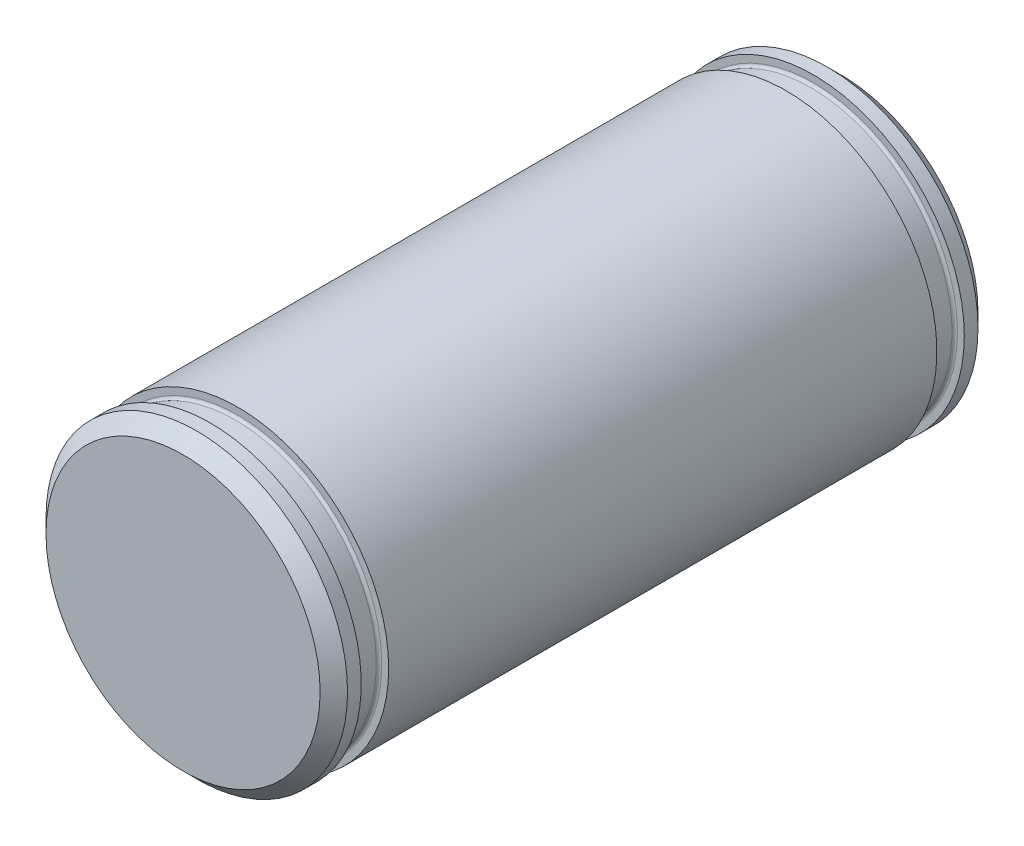
from build123d import *

# Parameters (mm, degrees)
ESQUISSE1_R      = 5.5
EXTRUSION1_DEPTH = 12
CHANFREIN1_SIZE  = 0.5
CHANFREIN2_SIZE  = 0.5


with BuildPart() as part:
    # Esquisse1 → Extrusion1 (new, symmetric)
    with BuildSketch(Plane.XY):
        Circle(ESQUISSE1_R)
    extrude(amount=EXTRUSION1_DEPTH, both=True)

    # Chanfrein1
    chanfrein1_edges = [part.edges().sort_by_distance(p)[0] for p in [
        (-5.5, 0, 12),
    ]]
    chamfer(chanfrein1_edges, length=CHANFREIN1_SIZE)

    # Chanfrein2
    chanfrein2_edges = [part.edges().sort_by_distance(p)[0] for p in [
        (-5.5, 0, -12),
    ]]
    chamfer(chanfrein2_edges, length=CHANFREIN2_SIZE)

    # Esquisse3 → Gorge pour ANSI B27.8M - 3DM1-11, Circlip haut rendement1 (revolve, cut)
    with BuildSketch(Plane(origin=(0, 0, 24), x_dir=(0, 1, 0), z_dir=(-1, 0, 0)), mode=Mode.PRIVATE) as gorge_pour_ansi_b27_8m_3dm1_11_circli_sk:
        with BuildLine():
            Line((5.25, 13), (6.6, 13))
            Line((6.6, 13), (6.6, 14))
            Line((6.6, 14), (5.25, 14))
            ThreePointArc((5.25, 14), (5.179289322, 13.970710678), (5.15, 13.9))
            Line((5.15, 13.9), (5.15, 13.1))
            ThreePointArc((5.15, 13.1), (5.179289322, 13.029289322), (5.25, 13))
        make_face()
    gorge_pour_ansi_b27_8m_3dm1_11_circli = revolve(gorge_pour_ansi_b27_8m_3dm1_11_circli_sk.sketch.rotate(Axis((0, 0, 74), (0, 0, -1)), 270), axis=Axis((0, 0, 74), (0, 0, -1)), mode=Mode.SUBTRACT)

    # Symétrie1: Gorge pour ANSI B27.8M - 3DM1-11, Circlip haut rendement1 across plane
    add(gorge_pour_ansi_b27_8m_3dm1_11_circli.mirror(Plane.XY), mode=Mode.SUBTRACT)


solid = part.part
